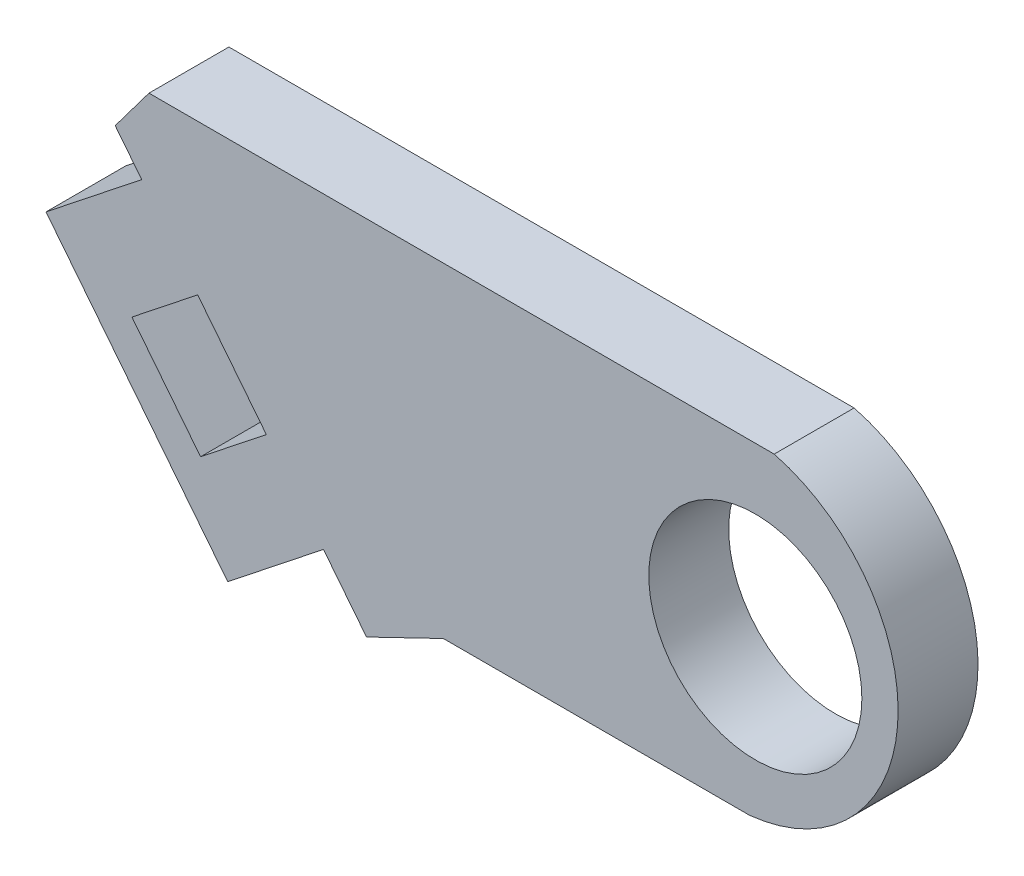
from build123d import *

# Parameters (mm, degrees)
SKETCH1_R           = 4
BOSS_EXTRUDE1_DEPTH = 3


with BuildPart() as part:
    # Sketch1 → Boss-Extrude1 (new body)
    with BuildSketch(Plane.XY):
        with BuildLine():
            Line((-3.41129842, 4.305994118), (3.41129842, -4.305994118))
            Line((3.41129842, -4.305994118), (7.005179011, -1.458846897))
            Line((7.005179011, -1.458846897), (8.621253306, -3.498775848))
            Line((8.621253306, -3.498775848), (11.505363509, -2.105535978))
            Line((11.505363509, -2.105535978), (23.000363507, -2.105335353))
            ThreePointArc((23.000363507, -2.105335353), (28.559669511, 3.611172521), (23.925659877, 10.100417487))
            Line((23.925659877, 10.100417487), (0.454659877, 10.100417487))
            Line((0.454659877, 10.100417487), (-0.813143143, 8.410019752))
            Line((-0.813143143, 8.410019752), (0.182582172, 7.153141338))
            Line((0.182582172, 7.153141338), (-3.41129842, 4.305994118))
        make_face()
        with Locations((23.217363507, 3.802664647)):
            Circle(SKETCH1_R, mode=Mode.SUBTRACT)
        Polygon((2.283340507, 4.456152944), (4.860365799, 1.203240304), (2.39128753, -0.752815038), (-0.185737762, 2.500097602), align=None, mode=Mode.SUBTRACT)
    extrude(amount=-BOSS_EXTRUDE1_DEPTH)


solid = part.part
